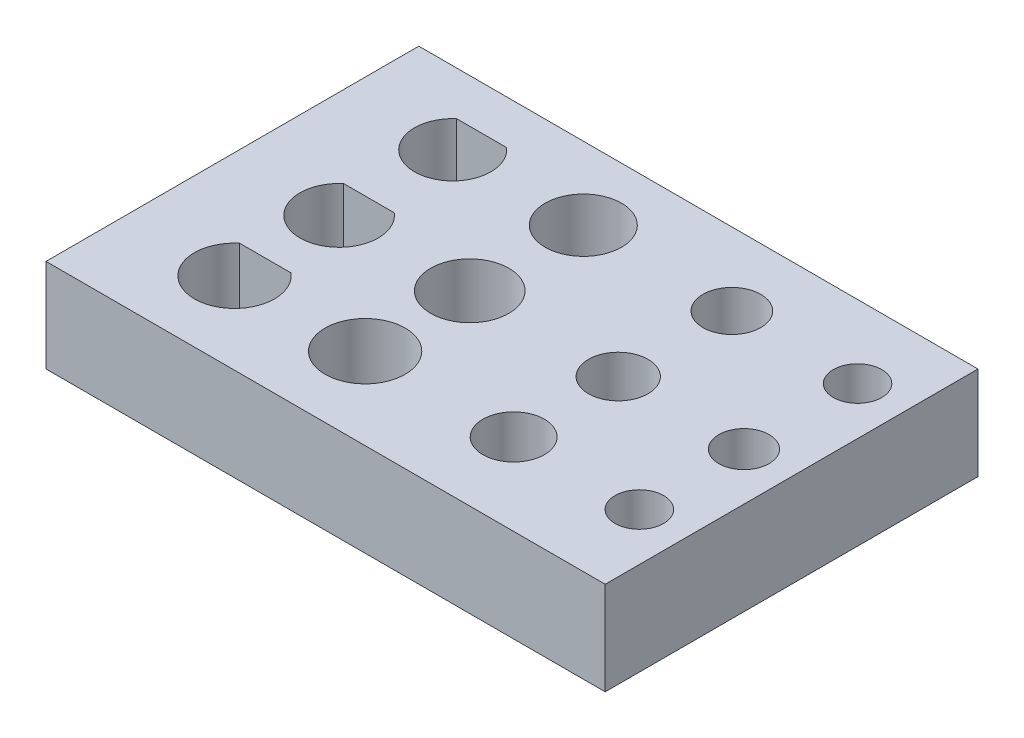
from build123d import *

# Parameters (mm, degrees)
SKETCH2_W           = 30
SKETCH2_H           = 20
BOSS_EXTRUDE1_DEPTH = 5
SKETCH5_R           = 1.35
SKETCH5_R_2         = 1.6
SKETCH5_R_3         = 2.1
SKETCH5_R_4         = 1.55
SKETCH5_R_5         = 1.3
SKETCH5_R_6         = 2.05
SKETCH5_R_7         = 1.65
SKETCH5_R_8         = 2.15
CUT_EXTRUDE3_DEPTH  = 37.400549446


with BuildPart() as part:
    # Sketch2 → Boss-Extrude1 (new body)
    with BuildSketch(Plane(origin=(0, 0, 0), x_dir=(1, 0, 0), z_dir=(0, 1, 0))):
        with Locations((15, 10)):
            Rectangle(SKETCH2_W, SKETCH2_H)
    extrude(amount=BOSS_EXTRUDE1_DEPTH)

    # Sketch5 → Cut-Extrude3 (cut, through all)
    with BuildSketch(Plane(origin=(0, 5, 0), x_dir=(1, 0, 0), z_dir=(0, 1, 0))):
        with Locations((27.444530449, 10)):
            Circle(SKETCH5_R)
        with Locations((20.700795765, 10)):
            Circle(SKETCH5_R_2)
        with Locations((12.732583582, 10)):
            Circle(SKETCH5_R_3)
        with Locations((20.700795765, 16.093784601)):
            Circle(SKETCH5_R_4)
        with Locations((27.444530449, 16.093784601)):
            Circle(SKETCH5_R_5)
        with Locations((12.732583582, 16.093784601)):
            Circle(SKETCH5_R_6)
        with Locations((20.700795765, 4.387736866)):
            Circle(SKETCH5_R_7)
        with Locations((27.444530449, 4.387736866)):
            Circle(SKETCH5_R_5)
        with Locations((12.732583582, 4.387736866)):
            Circle(SKETCH5_R_8)
        with BuildLine():
            Line((4.365184557, 11.6), (7.085478659, 11.6))
            ThreePointArc((7.085478659, 11.6), (5.725331608, 7.9), (4.365184557, 11.6))
        make_face()
        with BuildLine():
            Line((4.346926733, 6.037736866), (7.103736483, 6.037736866))
            ThreePointArc((7.103736483, 6.037736866), (5.725331608, 2.237736866), (4.346926733, 6.037736866))
        make_face()
        with BuildLine():
            Line((4.383690822, 17.643784601), (7.066972395, 17.643784601))
            ThreePointArc((7.066972395, 17.643784601), (5.725331608, 14.043784601), (4.383690822, 17.643784601))
        make_face()
    extrude(amount=-CUT_EXTRUDE3_DEPTH, mode=Mode.SUBTRACT)


solid = part.part
